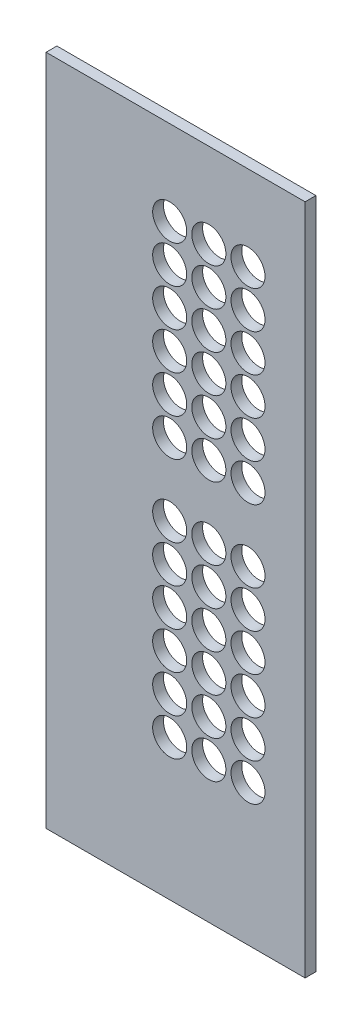
from build123d import *

# Parameters (mm, degrees)
SKETCH1_W           = 56.55
SKETCH1_H           = 197.425
BOSS_EXTRUDE1_DEPTH = 3.175
SKETCH2_R           = 5
CUT_EXTRUDE1_DEPTH  = 10
LPATTERN1_COUNT     = 6
LPATTERN1_PITCH     = 11
SKETCH5_W           = 3.175
SKETCH5_H           = 197.425
BOSS_EXTRUDE2_DEPTH = 19.525


with BuildPart() as part:
    # Sketch1 → Boss-Extrude1 (new body)
    with BuildSketch(Plane.XY):
        Rectangle(SKETCH1_W, SKETCH1_H)
    extrude(amount=BOSS_EXTRUDE1_DEPTH)

    # Sketch2 → Cut-Extrude1 (cut)
    with BuildSketch(Plane(origin=(0, 0, 0), x_dir=(-1, 0, 0), z_dir=(0, 0, -1))):
        with Locations((11.5, -57.369162839)):
            Circle(SKETCH2_R)
        with Locations((-11.5, -57.369162839)):
            Circle(SKETCH2_R)
        with Locations((11.5, 18.830837161)):
            Circle(SKETCH2_R)
        with Locations((0, 18.830837161)):
            Circle(SKETCH2_R)
        with Locations((-11.5, 18.830837161)):
            Circle(SKETCH2_R)
        with Locations((0, -57.369162839)):
            Circle(SKETCH2_R)
    cut_extrude1 = extrude(amount=-CUT_EXTRUDE1_DEPTH, mode=Mode.SUBTRACT)

    # LPattern1: Cut-Extrude1 ×6
    with Locations(*[(0, i * LPATTERN1_PITCH, 0) for i in range(1, LPATTERN1_COUNT)]):
        add(cut_extrude1, mode=Mode.SUBTRACT)

    # Sketch5 → Boss-Extrude2 (add)
    with BuildSketch(Plane.ZY.offset(28.275)):
        with Locations((1.5875, 0)):
            Rectangle(SKETCH5_W, SKETCH5_H)
    extrude(amount=BOSS_EXTRUDE2_DEPTH)


solid = part.part
